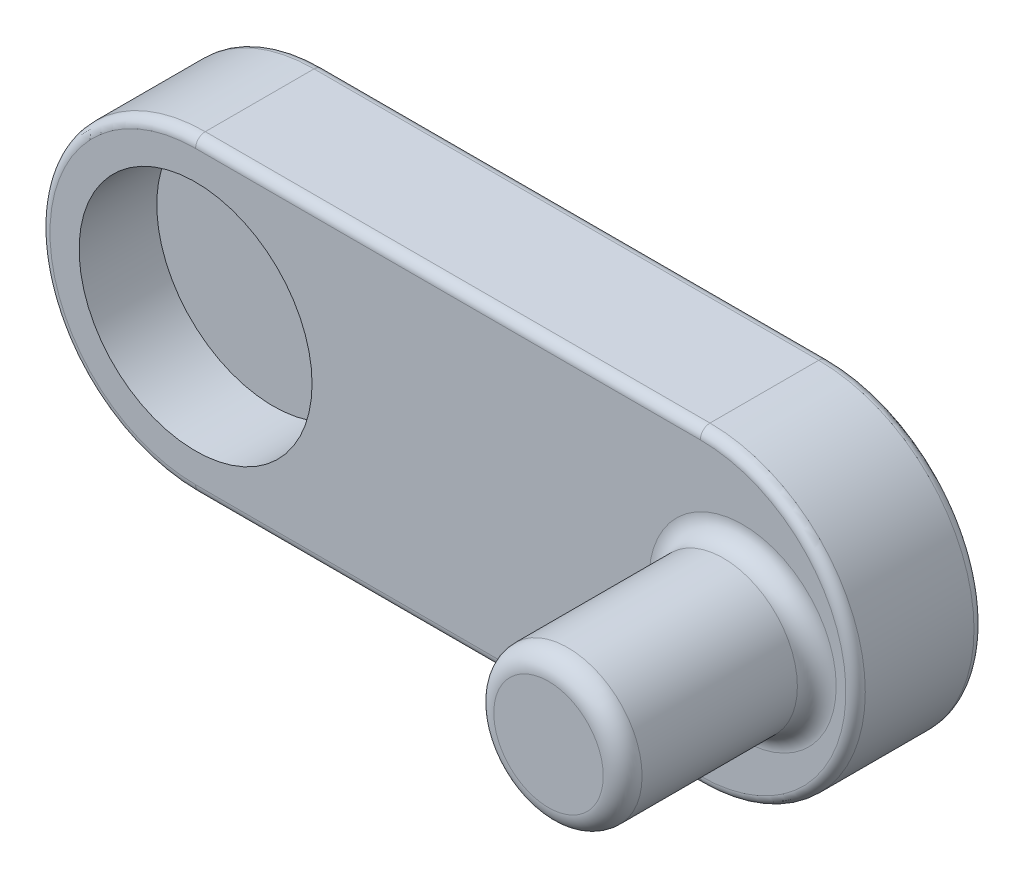
from build123d import *

# Parameters (mm, degrees)
SALIENTE_EXTRUIR1_DEPTH = 33
REDONDEO1_R             = 2.5
CROQUIS2_R              = 30
CORTAR_EXTRUIR1_DEPTH   = 20
CROQUIS3_R              = 30
CORTAR_EXTRUIR2_DEPTH   = 20
CROQUIS4_R              = 19.096631059
SALIENTE_EXTRUIR2_DEPTH = 50
REDONDEO2_R             = 5


with BuildPart() as part:
    # Croquis1 → Saliente-Extruir1 (new body)
    with BuildSketch(Plane.XY):
        with BuildLine():
            Line((0, 40), (130, 40))
            ThreePointArc((130, 40), (170, 0), (130, -40))
            Line((130, -40), (0, -40))
            ThreePointArc((0, -40), (-40, 0), (0, 40))
        make_face()
    extrude(amount=SALIENTE_EXTRUIR1_DEPTH)

    # Redondeo1
    redondeo1_edges = [part.edges().sort_by_distance(p)[0] for p in [
        (170, 0, 33),
        (65, 40, 33),
        (-40, 0, 33),
        (65, 40, 0),
        (170, 0, 0),
        (65, -40, 0),
        (-40, 0, 0),
        (65, -40, 33),
    ]]
    fillet(redondeo1_edges, radius=REDONDEO1_R)

    # Croquis2 → Cortar-Extruir1 (cut)
    with BuildSketch(Plane.XY.offset(33)):
        Circle(CROQUIS2_R)
    extrude(amount=-CORTAR_EXTRUIR1_DEPTH, mode=Mode.SUBTRACT)

    # Croquis3 → Cortar-Extruir2 (cut)
    with BuildSketch(Plane(origin=(0, 0, 0), x_dir=(-1, 0, 0), z_dir=(0, 0, -1))):
        with Locations((-130, 0)):
            Circle(CROQUIS3_R)
    extrude(amount=-CORTAR_EXTRUIR2_DEPTH, mode=Mode.SUBTRACT)

    # Croquis4 → Saliente-Extruir2 (add)
    with BuildSketch(Plane.XY.offset(33)):
        with Locations((140.909108461, 0)):
            Circle(CROQUIS4_R)
    extrude(amount=SALIENTE_EXTRUIR2_DEPTH)

    # Redondeo2
    redondeo2_edges = [part.edges().sort_by_distance(p)[0] for p in [
        (121.812477402, 0, 33),
        (121.812477402, 0, 83),
    ]]
    fillet(redondeo2_edges, radius=REDONDEO2_R)


solid = part.part
